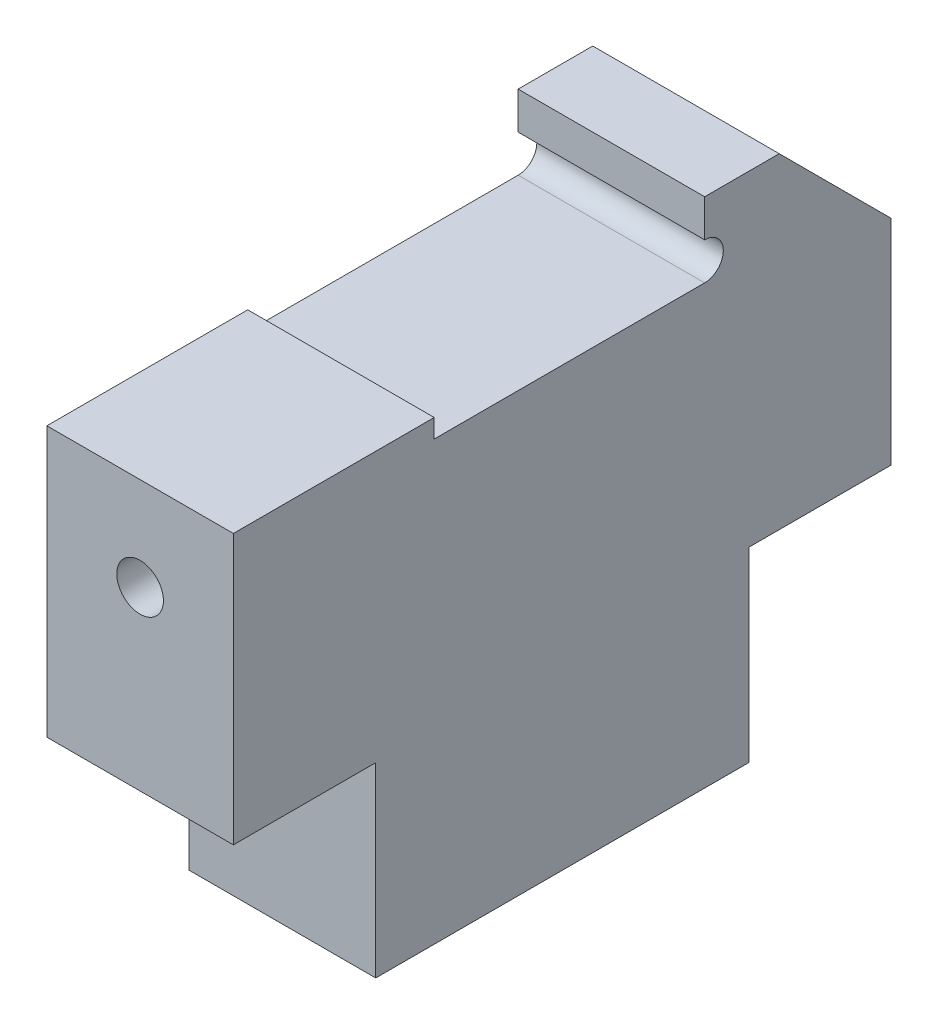
from build123d import *

# Parameters (mm, degrees)
BOSS_EXTRUDE1_DEPTH       = 10
CHAMFER1_SIZE             = 6
M3X0_5_TAPPED_HOLE1_D     = 2.5
M3X0_5_TAPPED_HOLE1_DEPTH = 14.5
M3X0_5_TAPPED_HOLE1_TIP   = 0.751075774


with BuildPart() as part:
    # Sketch1 → Boss-Extrude1 (new body)
    with BuildSketch(Plane(origin=(0, 0, 0), x_dir=(0, 0, -1), z_dir=(1, 0, 0))):
        with BuildLine():
            Line((0, 1), (0, 3))
            Line((0, 3), (10, 3))
            Line((10, 3), (10, -14.46))
            Line((10, -14.46), (2.365, -14.46))
            Line((2.365, -14.46), (2.365, -24.46))
            Line((2.365, -24.46), (-17.635, -24.46))
            Line((-17.635, -24.46), (-17.635, -14.46))
            Line((-17.635, -14.46), (-25.27, -14.46))
            Line((-25.27, -14.46), (-25.27, 0))
            Line((-25.27, 0), (-14.5, 0))
            Line((-14.5, 0), (-14.5, -1))
            Line((-14.5, -1), (0, -1))
            ThreePointArc((0, -1), (1, 0), (0, 1))
        make_face()
    extrude(amount=-BOSS_EXTRUDE1_DEPTH)

    # Chamfer1
    chamfer1_edges = [part.edges().sort_by_distance(p)[0] for p in [
        (-5, 3, -10),
    ]]
    chamfer(chamfer1_edges, length=CHAMFER1_SIZE)

    # M3x0.5 Tapped Hole1
    with Locations(Plane(origin=(-5, -5, 25.27), x_dir=(1, 0, 0), z_dir=(0, 0, 1))):
        with Locations((0, 0)):
            Hole(M3X0_5_TAPPED_HOLE1_D / 2, depth=M3X0_5_TAPPED_HOLE1_DEPTH)
            with Locations((0, 0, -(M3X0_5_TAPPED_HOLE1_DEPTH + M3X0_5_TAPPED_HOLE1_TIP / 2))):  # 118° drill point
                Cone(0, M3X0_5_TAPPED_HOLE1_D / 2, M3X0_5_TAPPED_HOLE1_TIP, mode=Mode.SUBTRACT)


solid = part.part
